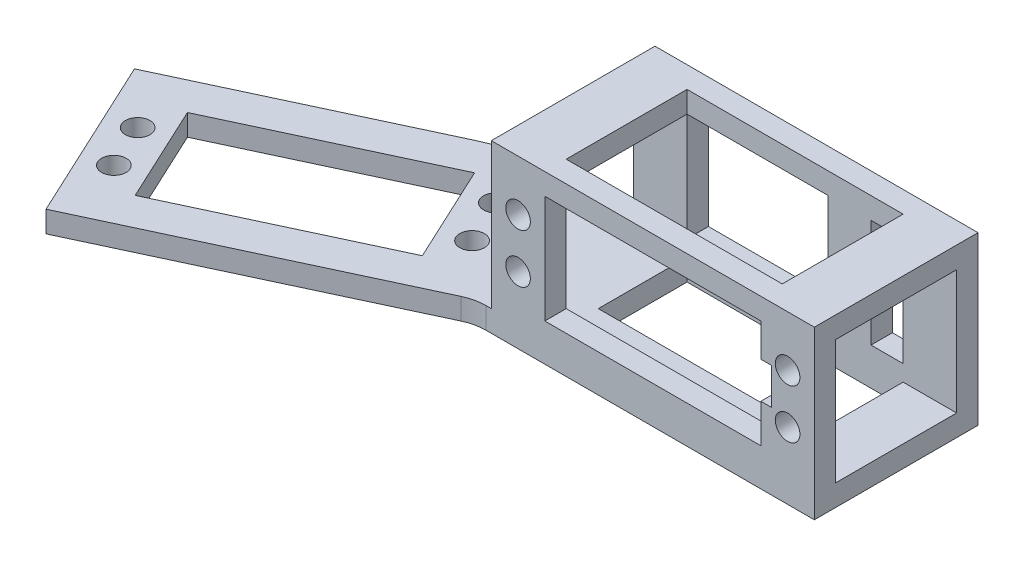
from build123d import *

# Parameters (mm, degrees)
SZKIC1_W                    = 60.4
SZKIC1_H                    = 34.2
DODANIE_WYCI_GNI_CIE1_DEPTH = 4
SZKIC2_R                    = 2.3
DODANIE_WYCI_GNI_CIE2_DEPTH = 4
SZKIC8_W                    = 60.4
SZKIC8_H                    = 32.2
SZKIC8_R                    = 2.3
SZKIC8_W_2                  = 40.4
SZKIC8_H_2                  = 20.2
DODANIE_WYCI_GNI_CIE3_DEPTH = 4
SZKIC10_R                   = 1.5
DODANIE_WYCI_GNI_CIE4_DEPTH = 4
DODANIE_WYCI_GNI_CIE5_START = -2
SZKIC11_W                   = 10
SZKIC11_H                   = 30.6
DODANIE_WYCI_GNI_CIE5_DEPTH = 5
WYTNIJ_WYCI_GNI_CIE1_DEPTH  = 3
SZKIC13_W                   = 6
SZKIC13_H                   = 20.2
SZKIC13_W_2                 = 26.4
WYTNIJ_WYCI_GNI_CIE2_DEPTH  = 4
WYTNIJ_WYCI_GNI_CIE3_REACH  = 94.401
SZKIC14_W                   = 2
SZKIC14_H                   = 6.8


with BuildPart() as part:
    # Szkic1 → Dodanie-wyciągnięcie1 (new body)
    with BuildSketch(Plane.XY):
        with Locations((20.2, 10.1)):
            Rectangle(SZKIC1_W, SZKIC1_H)
    extrude(amount=DODANIE_WYCI_GNI_CIE1_DEPTH)

    # Szkic2 → Dodanie-wyciągnięcie2 (add)
    with BuildSketch(Plane.XZ.offset(7)):
        with BuildLine():
            Line((-10, 4), (-10, 0))
            Line((-10, 0), (-16.721262857, 0))
            ThreePointArc((-16.721262857, 0), (-28.023032854, 1.237745118), (-38.789008699, 4.89230147))
            Line((-38.789008699, 4.89230147), (-82.189786852, 25.130416692))
            Line((-82.189786852, 25.130416692), (-67.736242301, 56.126143009))
            Line((-67.736242301, 56.126143009), (-14.803564356, 31.443229917))
            ThreePointArc((-14.803564356, 31.443229917), (-12.947956525, 30.813335936), (-11, 30.6))
            Line((-11, 30.6), (-10, 30.6))
            Line((-10, 30.6), (50.4, 30.6))
            Line((50.4, 30.6), (50.4, 4))
            Line((50.4, 4), (40.4, 4))
            Line((40.4, 4), (40.4, 20.6))
            Line((40.4, 20.6), (0, 20.6))
            Line((0, 20.6), (0, 4))
            Line((0, 4), (-10, 4))
        make_face()
        with Locations(Location((-68.487431637, 42.684204362, 0), (0, 0, 270))):
            Circle(SZKIC2_R, mode=Mode.SUBTRACT)
        with Locations(Location((-22.809519171, 21.384243971, 0), (0, 0, 90))):
            Circle(SZKIC2_R, mode=Mode.SUBTRACT)
        with Locations(Location((-26.697607179, 13.04621233, 0), (0, 0, 270))):
            Circle(SZKIC2_R, mode=Mode.SUBTRACT)
        with Locations(Location((-72.375519645, 34.346172722, 0), (0, 0, 90))):
            Circle(SZKIC2_R, mode=Mode.SUBTRACT)
        Polygon((-61.631492263, 45.555805882), (-70.16838115, 27.248388584), (-33.553546554, 10.17461081), (-25.016657666, 28.482028108), align=None, mode=Mode.SUBTRACT)
    extrude(amount=-DODANIE_WYCI_GNI_CIE2_DEPTH)

    # Szkic8 → Dodanie-wyciągnięcie3 (add)
    with BuildSketch(Plane.XY.offset(30.6)):
        with Locations((20.2, 9.1)):
            Rectangle(SZKIC8_W, SZKIC8_H)
        with Locations((-5, 14.7)):
            Circle(SZKIC8_R, mode=Mode.SUBTRACT)
        with Locations(Location((-5, 5.5, 0), (0, 0, 180))):
            Circle(SZKIC8_R, mode=Mode.SUBTRACT)
        with Locations((45.4, 5.5)):
            Circle(SZKIC8_R, mode=Mode.SUBTRACT)
        with Locations(Location((45.4, 14.7, 0), (0, 0, 180))):
            Circle(SZKIC8_R, mode=Mode.SUBTRACT)
        with Locations((20.2, 10.1)):
            Rectangle(SZKIC8_W_2, SZKIC8_H_2, mode=Mode.SUBTRACT)
    extrude(amount=-DODANIE_WYCI_GNI_CIE3_DEPTH)

    # Szkic10 → Dodanie-wyciągnięcie4 (add)
    with BuildSketch(Plane(origin=(0, 0, 0), x_dir=(-1, 0, 0), z_dir=(0, 0, -1))):
        with Locations(Location((-30.4, 10.1, 0), (0, 0, 180))):
            Circle(SZKIC10_R)
    extrude(amount=DODANIE_WYCI_GNI_CIE4_DEPTH)

    # Szkic11 → Dodanie-wyciągnięcie5 (add)
    with BuildSketch(Plane(origin=(0, 27.2, 0), x_dir=(1, 0, 0), z_dir=(0, 1, 0)).offset(DODANIE_WYCI_GNI_CIE5_START)):
        with Locations((-5, -15.3)):
            Rectangle(SZKIC11_W, SZKIC11_H)
        with Locations((45.4, -15.3)):
            Rectangle(SZKIC11_W, SZKIC11_H)
    extrude(amount=-DODANIE_WYCI_GNI_CIE5_DEPTH)

    # Szkic12 → Wytnij-wyciągnięcie1 (cut)
    with BuildSketch(Plane(origin=(0, 27.2, 0), x_dir=(1, 0, 0), z_dir=(0, 1, 0))):
        Polygon((-10, 0), (50.4, 0), (50.4, -4), (50.4, -30.6), (-10, -30.6), (-10, -4), align=None)
    extrude(amount=-WYTNIJ_WYCI_GNI_CIE1_DEPTH, mode=Mode.SUBTRACT)

    # Szkic13 → Wytnij-wyciągnięcie2 (cut)
    with BuildSketch(Plane(origin=(0, 0, 0), x_dir=(-1, 0, 0), z_dir=(0, 0, -1))):
        with Locations((-37.4, 10.1)):
            Rectangle(SZKIC13_W, SZKIC13_H)
        with Locations((-13.2, 10.1)):
            Rectangle(SZKIC13_W_2, SZKIC13_H)
    extrude(amount=-WYTNIJ_WYCI_GNI_CIE2_DEPTH, mode=Mode.SUBTRACT)

    # Szkic14 → Wytnij-wyciągnięcie3 (cut, up to next)
    with BuildSketch(Plane.XY.offset(30.6), mode=Mode.PRIVATE) as wytnij_wyci_gni_cie3_sk1:
        with Locations((41.4, 10.6)):
            Rectangle(SZKIC14_W, SZKIC14_H)
    wytnij_wyci_gni_cie3_tool1 = extrude(wytnij_wyci_gni_cie3_sk1.sketch, amount=-WYTNIJ_WYCI_GNI_CIE3_REACH, mode=Mode.PRIVATE) & part.part
    add(wytnij_wyci_gni_cie3_tool1.solids().sort_by_distance((41.4, 10.6, 30.6))[0], mode=Mode.SUBTRACT)


solid = part.part
